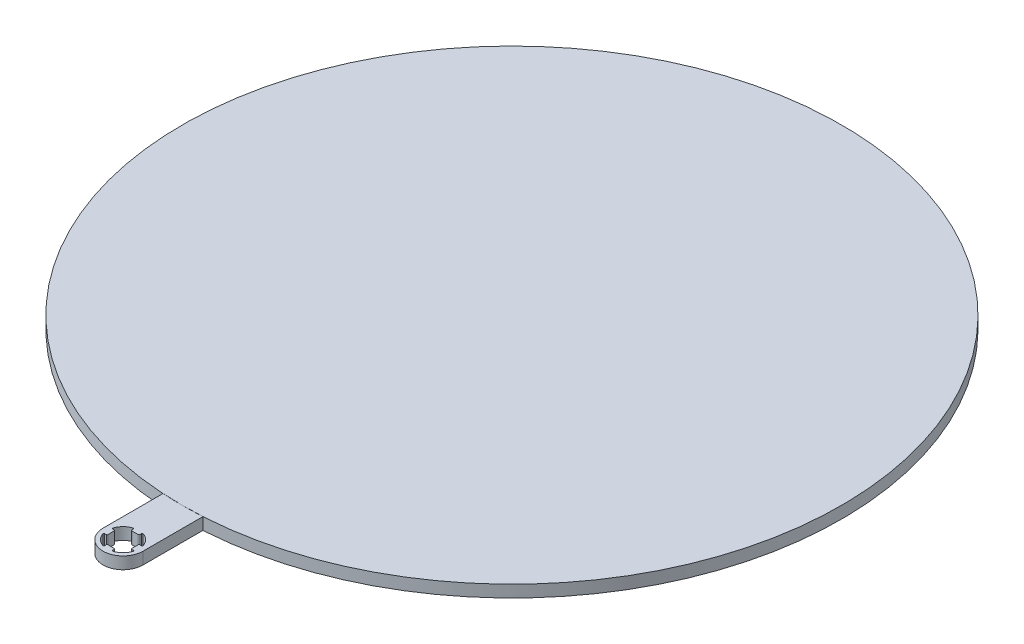
from build123d import *

# Parameters (mm, degrees)
SKETCH1_R           = 82.5
BOSS_EXTRUDE1_DEPTH = 3
SKETCH11_R          = 4
BOSS_EXTRUDE8_DEPTH = 3
BOSS_EXTRUDE9_DEPTH = 3
FILLET1_R           = 0.2


with BuildPart() as part:
    # Sketch1 → Boss-Extrude1 (new body)
    with BuildSketch(Plane(origin=(0, 0, 0), x_dir=(1, 0, 0), z_dir=(0, 1, 0))):
        with Locations(Location((0, 0, 0), (0, 0, 270))):
            Circle(SKETCH1_R)
    extrude(amount=BOSS_EXTRUDE1_DEPTH)


with BuildPart() as body_2:
    # Sketch11 → Boss-Extrude8 (new, through all)
    with BuildSketch(Plane(origin=(0, 3, 0), x_dir=(1, 0, 0), z_dir=(0, 1, 0))):
        with BuildLine():
            ThreePointArc((5, -82.34834546), (0, -82.5), (-5, -82.34834546))
            Line((-5, -82.34834546), (-5, -97.34834546))
            ThreePointArc((-5, -97.34834546), (0, -102.34834546), (5, -97.34834546))
            Line((5, -97.34834546), (5, -82.34834546))
        make_face()
        with Locations(Location((0, -97.34834546, 0), (0, 0, 270))):
            Circle(SKETCH11_R, mode=Mode.SUBTRACT)
    extrude(amount=-BOSS_EXTRUDE8_DEPTH)

    # Sketch12 → Boss-Extrude9 (add, through all)
    with BuildSketch(Plane(origin=(0, 3, 0), x_dir=(1, 0, 0), z_dir=(0, 1, 0))):
        with BuildLine():
            Line((-1, -93.475362114), (-1, -94.34834546))
            Line((-1, -94.34834546), (1, -94.34834546))
            Line((1, -94.34834546), (1, -93.475362114))
            ThreePointArc((1, -93.475362114), (0, -93.34834546), (-1, -93.475362114))
        make_face()
        with BuildLine():
            Line((3.872983346, -96.34834546), (3, -96.34834546))
            Line((3, -96.34834546), (3, -98.34834546))
            Line((3, -98.34834546), (3.872983346, -98.34834546))
            ThreePointArc((3.872983346, -98.34834546), (4, -97.34834546), (3.872983346, -96.34834546))
        make_face()
        with BuildLine():
            Line((1, -101.221328806), (1, -100.34834546))
            Line((1, -100.34834546), (-1, -100.34834546))
            Line((-1, -100.34834546), (-1, -101.221328806))
            ThreePointArc((-1, -101.221328806), (0, -101.34834546), (1, -101.221328806))
        make_face()
        with BuildLine():
            Line((-3.872983346, -98.34834546), (-3, -98.34834546))
            Line((-3, -98.34834546), (-3, -96.34834546))
            Line((-3, -96.34834546), (-3.872983346, -96.34834546))
            ThreePointArc((-3.872983346, -96.34834546), (-4, -97.34834546), (-3.872983346, -98.34834546))
        make_face()
    extrude(amount=-BOSS_EXTRUDE9_DEPTH)

    # Fillet1
    fillet1_edges = [body_2.edges().sort_by_distance(p)[0] for p in [
        (-1, 1.5, 93.475362114),
        (1, 1.5, 93.475362114),
        (1, 1.5, 94.34834546),
        (-1, 1.5, 94.34834546),
        (3.872983346, 1.5, 96.34834546),
        (3.872983346, 1.5, 98.34834546),
        (3, 1.5, 98.34834546),
        (3, 1.5, 96.34834546),
        (1, 1.5, 101.221328806),
        (-1, 1.5, 101.221328806),
        (-1, 1.5, 100.34834546),
        (1, 1.5, 100.34834546),
        (-3.872983346, 1.5, 98.34834546),
        (-3.872983346, 1.5, 96.34834546),
        (-3, 1.5, 96.34834546),
        (-3, 1.5, 98.34834546),
    ]]
    fillet(fillet1_edges, radius=FILLET1_R)


solid = Compound([part.part, body_2.part])
